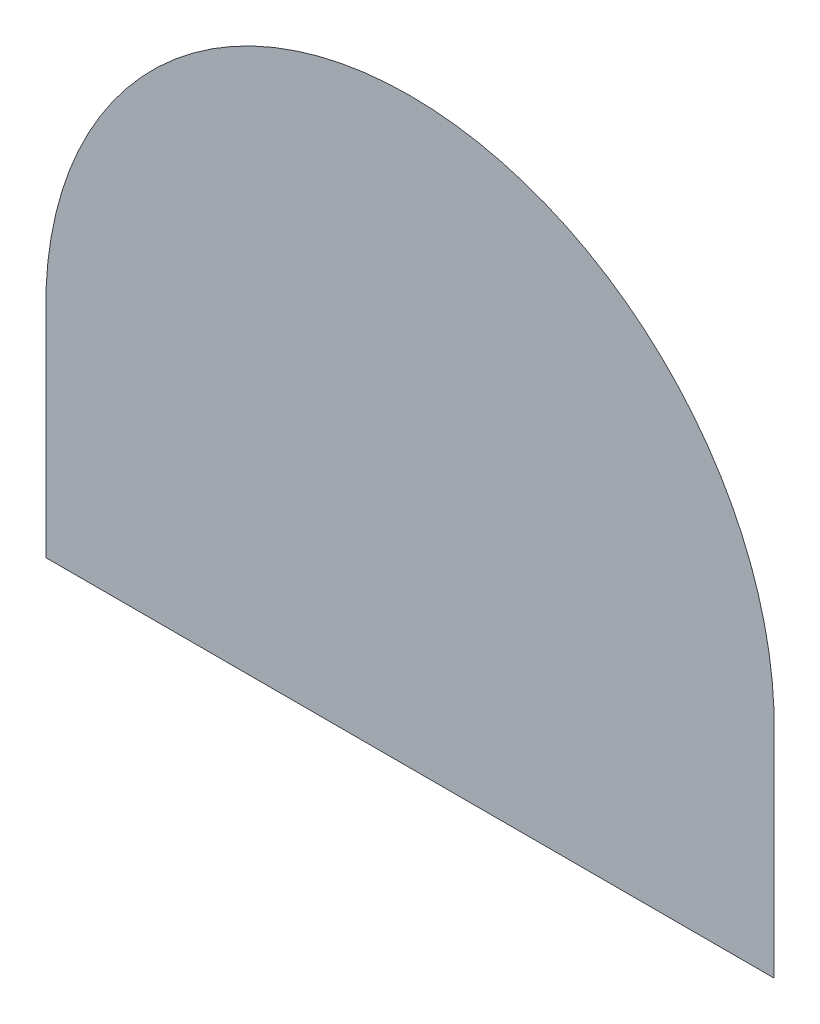
from build123d import *

# Parameters (mm, degrees)
BOSS_EXTRU_1_DEPTH = 0.0001


with BuildPart() as part:
    # Esquisse1 → Boss.-Extru.1 (new body)
    with BuildSketch(Plane.XY):
        with BuildLine():
            Line((5, 0), (5, 77))
            ThreePointArc((5, 77), (125, 192), (245, 77))
            Line((245, 77), (245, 0))
            Line((245, 0), (5, 0))
        make_face()
    extrude(amount=BOSS_EXTRU_1_DEPTH)


solid = part.part
